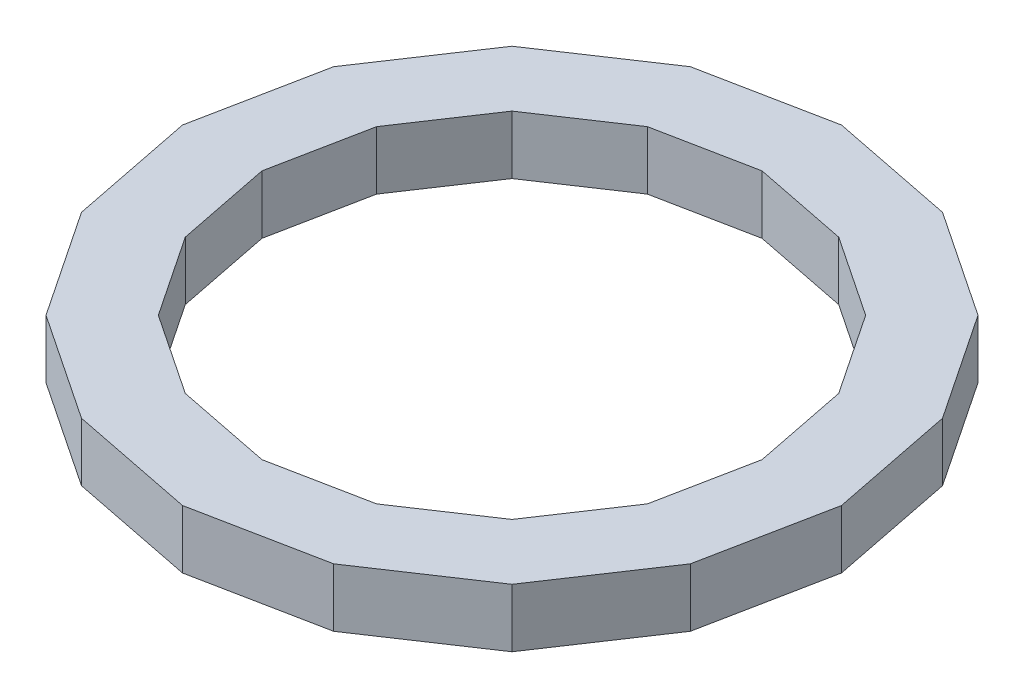
from build123d import *

# Parameters (mm, degrees)
BOSS_EXTRUDE1_DEPTH = 19.05


with BuildPart() as part:
    # Sketch1 → Boss-Extrude1 (new body)
    with BuildSketch(Plane(origin=(0, 0, 0), x_dir=(1, 0, 0), z_dir=(0, 1, 0))):
        Polygon((107.411786415, 0), (99.235551019, 41.104711102), (75.951602553, 75.951602553), (41.104711102, 99.235551019), (0, 107.411786415), (-41.104711102, 99.235551019), (-75.951602553, 75.951602553), (-99.235551019, 41.104711102), (-107.411786415, 0), (-99.235551019, -41.104711102), (-75.951602553, -75.951602553), (-41.104711102, -99.235551019), (0, -107.411786415), (41.104711102, -99.235551019), (75.951602553, -75.951602553), (99.235551019, -41.104711102), align=None)
        Polygon((81.514170996, 0), (75.309274193, 31.194122743), (57.639223074, 57.639223074), (31.194122743, 75.309274193), (0, 81.514170996), (-31.194122743, 75.309274193), (-57.639223074, 57.639223074), (-75.309274193, 31.194122743), (-81.514170996, 0), (-75.309274193, -31.194122743), (-57.639223074, -57.639223074), (-31.194122743, -75.309274193), (0, -81.514170996), (31.194122743, -75.309274193), (57.639223074, -57.639223074), (75.309274193, -31.194122743), align=None, mode=Mode.SUBTRACT)
    extrude(amount=BOSS_EXTRUDE1_DEPTH)


solid = part.part
